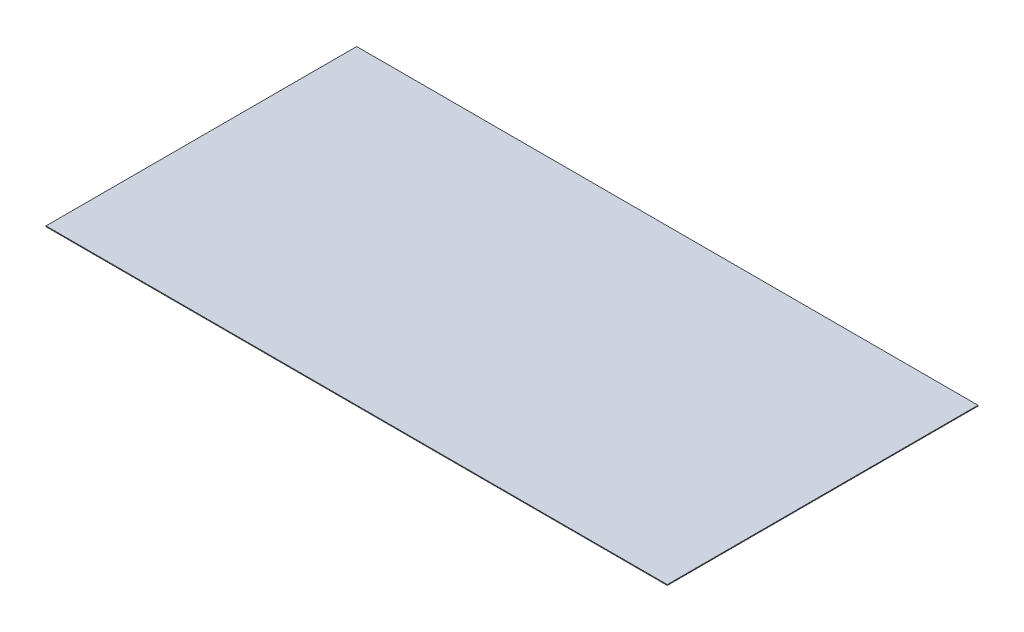
from build123d import *

# Parameters (mm, degrees)
SKETCH1_W           = 2440
SKETCH1_H           = 1220
BOSS_EXTRUDE1_DEPTH = 3


with BuildPart() as part:
    # Sketch1 → Boss-Extrude1 (new body)
    with BuildSketch(Plane(origin=(0, 0, 0), x_dir=(1, 0, 0), z_dir=(0, 1, 0))):
        Rectangle(SKETCH1_W, SKETCH1_H)
    extrude(amount=BOSS_EXTRUDE1_DEPTH)


solid = part.part
